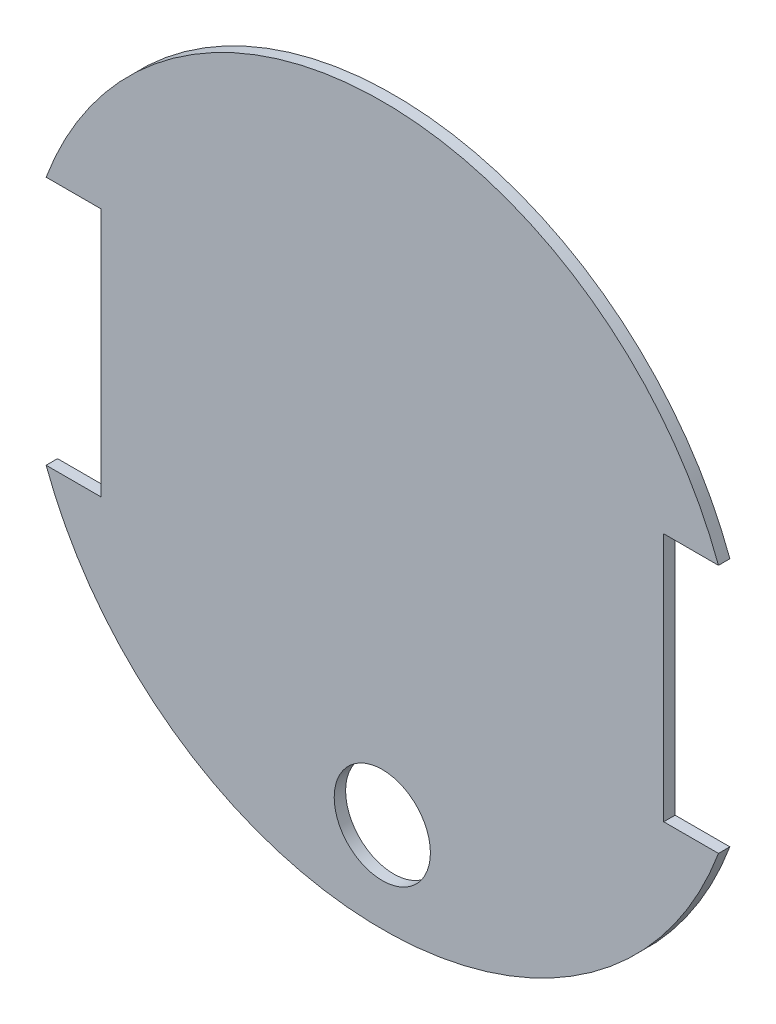
from build123d import *

# Parameters (mm, degrees)
P_IDAT_VYSUNUT_M4_DEPTH  = 1.5
SKICA14_W                = 0.314102564
SKICA14_H                = 3.58974359
P_IDAT_VYSUNUT_M14_DEPTH = 0.01
SKICA15_R                = 6.325
ODEBRAT_VYSUNUT_M1_DEPTH = 1.5


with BuildPart() as part:
    # Skica1 → Přidat vysunutím4 (new body)
    with BuildSketch(Plane.XY):
        with BuildLine():
            Line((-44.205910238, 16.4), (-37.005910238, 16.4))
            Line((-37.005910238, 16.4), (-37.005910238, 0))
            Line((-37.005910238, 0), (-37.005910238, -16.4))
            Line((-37.005910238, -16.4), (-44.205910238, -16.4))
            ThreePointArc((-44.205910238, -16.4), (0, -47.15), (44.205910238, -16.4))
            Line((44.205910238, -16.4), (37.005910238, -16.4))
            Line((37.005910238, -16.4), (37.005910238, 16.4))
            Line((37.005910238, 16.4), (44.205910238, 16.4))
            ThreePointArc((44.205910238, 16.4), (0, 47.15), (-44.205910238, 16.4))
        make_face()
    extrude(amount=P_IDAT_VYSUNUT_M4_DEPTH)

    # Skica14 → Přidat vysunutím14 (add)
    # profile 1 of 8: a face of its own
    with BuildSketch(Plane(origin=(0, 0, 0), x_dir=(-1, 0, 0), z_dir=(0, 0, -1))):
        with BuildLine():
            Line((18.951699298, -12.703544278), (19.249365437, -12.349113899))
            add(Edge.make_bspline(
                [(19.249365437, -12.349113899), (19.277774168, -12.377276494), (19.33296847, -12.431992585), (19.420532798, -12.503890464), (19.507934637, -12.56555007), (19.596192899, -12.615806732), (19.685044181, -12.654887688), (19.774370322, -12.682892359), (19.864095921, -12.700278444), (19.924231735, -12.702461158), (19.954072715, -12.703544278)],
                knots=[0, 0, 0, 0, 1.184182548, 2.300705631, 3.35101465, 4.348713429, 5.30352364, 6.219997949, 7.11671595, 8, 8, 8, 8], degree=3))
            add(Edge.make_bspline(
                [(19.954072715, -12.703544278), (19.978555201, -12.702781352), (20.026531658, -12.701286304), (20.097337158, -12.692385711), (20.165388961, -12.67615782), (20.231146838, -12.654301944), (20.294042089, -12.625385352), (20.354419906, -12.590815391), (20.412039743, -12.549661436), (20.466444479, -12.503025607), (20.515558167, -12.451396252), (20.559841777, -12.397479038), (20.596378637, -12.340278732), (20.627420876, -12.281232311), (20.650889524, -12.219364306), (20.66768728, -12.155100755), (20.677411997, -12.088434483), (20.67883051, -12.043171623), (20.679547399, -12.020296652)],
                knots=[0, 0, 0, 0, 1.062343549, 2.081793441, 3.089526549, 4.093074039, 5.083149132, 6.08769478, 7.107144672, 8.150642072, 9.191446818, 10.195194019, 11.172636708, 12.130818574, 13.084597393, 14.036430313, 15.007649973, 16, 16, 16, 16], degree=3))
            add(Edge.make_bspline(
                [(20.679547399, -12.020296652), (20.67869788, -11.995336478), (20.677028474, -11.946286788), (20.665368103, -11.87426166), (20.644157489, -11.806108981), (20.615791124, -11.741427558), (20.579433929, -11.680192302), (20.533845118, -11.623589824), (20.480897073, -11.569802345), (20.420087392, -11.520504096), (20.353252936, -11.475532844), (20.280706375, -11.436833514), (20.203719813, -11.403401331), (20.121674382, -11.37640517), (20.034975108, -11.355985544), (19.94368478, -11.340537352), (19.8474204, -11.331499982), (19.781491639, -11.330591203), (19.747783158, -11.330126557)],
                knots=[0, 0, 0, 0, 0.924643325, 1.817033356, 2.693143411, 3.56196673, 4.428389689, 5.322865367, 6.247706245, 7.219663084, 8.217806515, 9.227523221, 10.261305886, 11.32367458, 12.422559067, 13.558072142, 14.751475423, 16, 16, 16, 16], degree=3))
            add(Edge.make_bspline(
                [(19.747783158, -11.330126557), (19.734625478, -11.330222592), (19.706667713, -11.33042665), (19.662142588, -11.333665368), (19.612289908, -11.337716336), (19.577253316, -11.3413601), (19.558799772, -11.343279247)],
                knots=[0, 0, 0, 0, 0.832906839, 1.769781085, 2.82535828, 4, 4, 4, 4], degree=3))
            Line((19.558799772, -11.343279247), (19.718016544, -10.975696177))
            add(Edge.make_bspline(
                [(19.718016544, -10.975696177), (19.785657337, -10.976336571), (19.918518319, -10.977594442), (20.05101642, -10.987464825), (20.116058475, -10.992310101)],
                knots=[0, 0, 0, 0, 1.018219075, 2, 2, 2, 2], degree=3))
            add(Edge.make_bspline(
                [(20.116058475, -10.992310101), (20.143608766, -10.985009399), (20.198250267, -10.970529649), (20.277606205, -10.943588549), (20.353387431, -10.91225989), (20.425780198, -10.877080355), (20.493979593, -10.836823843), (20.559117305, -10.792889124), (20.620565197, -10.744678028), (20.67764768, -10.69209779), (20.729977739, -10.637695838), (20.775027033, -10.581018114), (20.814398673, -10.524625301), (20.845390866, -10.466489061), (20.871161684, -10.408260565), (20.888027903, -10.34855984), (20.899146831, -10.288248538), (20.900424487, -10.247732684), (20.901066386, -10.227377348)],
                knots=[0, 0, 0, 0, 1.165133019, 2.310850931, 3.423457707, 4.516327187, 5.598884803, 6.658713927, 7.727034368, 8.788835502, 9.829936608, 10.809811876, 11.746681257, 12.637474477, 13.499729694, 14.34472607, 15.168383402, 16, 16, 16, 16], degree=3))
            add(Edge.make_bspline(
                [(20.901066386, -10.227377348), (20.900724959, -10.209818724), (20.900052776, -10.175250318), (20.893046401, -10.124648749), (20.881159968, -10.076724179), (20.865235437, -10.031136764), (20.844291017, -9.987968132), (20.818646091, -9.947203828), (20.788520136, -9.908673716), (20.754133458, -9.873015344), (20.716123312, -9.840558333), (20.67528886, -9.811870658), (20.631359611, -9.788560877), (20.585153653, -9.768710766), (20.536109561, -9.753845009), (20.484548119, -9.742464711), (20.430255811, -9.736372644), (20.393201729, -9.735589861), (20.374266544, -9.735189848)],
                knots=[0, 0, 0, 0, 1.041626635, 2.05069436, 3.023903287, 3.968159788, 4.911422648, 5.86516543, 6.821265075, 7.809201593, 8.799981644, 9.783923408, 10.764332499, 11.746175287, 12.764125496, 13.800969656, 14.876262945, 16, 16, 16, 16], degree=3))
            add(Edge.make_bspline(
                [(20.374266544, -9.735189848), (20.352556696, -9.735550862), (20.309967782, -9.736259074), (20.24782261, -9.742907684), (20.188388535, -9.752017398), (20.132566, -9.766980935), (20.079218727, -9.784627446), (20.02965134, -9.807727861), (19.982742134, -9.834131543), (19.93900043, -9.864548282), (19.898632082, -9.899564144), (19.861329318, -9.938251054), (19.826921789, -9.981034487), (19.796066291, -10.027950643), (19.76807845, -10.079123508), (19.743403725, -10.134235558), (19.721792357, -10.193505319), (19.710138317, -10.234679068), (19.704171608, -10.255759468)],
                knots=[0, 0, 0, 0, 1.124438518, 2.205847547, 3.23580198, 4.236257647, 5.196617452, 6.143561762, 7.06448614, 7.983234858, 8.898788462, 9.828902619, 10.764380359, 11.73929134, 12.734518171, 13.783382522, 14.865121964, 16, 16, 16, 16], degree=3))
            Line((19.704171608, -10.255759468), (19.562953253, -10.255759468))
            Line((19.562953253, -10.255759468), (19.638408158, -9.731036367))
            add(Edge.make_bspline(
                [(19.638408158, -9.731036367), (19.680570379, -9.720600834), (19.763020267, -9.700193737), (19.885092062, -9.675006849), (20.00230202, -9.652711116), (20.115045044, -9.63356988), (20.223625352, -9.619863628), (20.327767089, -9.61030305), (20.427250307, -9.603529918), (20.492168892, -9.602688382), (20.523791861, -9.602278456)],
                knots=[0, 0, 0, 0, 1.162252488, 2.272830659, 3.334969625, 4.355229883, 5.332558806, 6.262852798, 7.153805453, 8, 8, 8, 8], degree=3))
            add(Edge.make_bspline(
                [(20.523791861, -9.602278456), (20.555647405, -9.602612467), (20.617823447, -9.603264394), (20.708452084, -9.610197909), (20.794162457, -9.622086726), (20.875068696, -9.63794299), (20.95171507, -9.657529636), (21.023018786, -9.683484995), (21.089708138, -9.713208636), (21.15142762, -9.746745519), (21.206550128, -9.784914672), (21.255556662, -9.825230377), (21.295905009, -9.869851131), (21.330791295, -9.915918176), (21.356183923, -9.966614689), (21.375225084, -10.019513158), (21.386689721, -10.075746669), (21.387827244, -10.114257282), (21.388408158, -10.133924025)],
                knots=[0, 0, 0, 0, 1.356238434, 2.647122798, 3.867146827, 5.038731331, 6.15646487, 7.231806646, 8.265353271, 9.263596312, 10.217479168, 11.11698148, 11.958367335, 12.773942467, 13.569322066, 14.361783278, 15.163389392, 16, 16, 16, 16], degree=3))
            add(Edge.make_bspline(
                [(21.388408158, -10.133924025), (21.387558947, -10.15520703), (21.385857034, -10.197860497), (21.373589053, -10.26107101), (21.354170991, -10.323454617), (21.325943168, -10.384512232), (21.290573932, -10.444862439), (21.247139892, -10.504172474), (21.195517458, -10.562108317), (21.13664923, -10.619893463), (21.068972309, -10.675615295), (20.994282466, -10.731099014), (20.911364578, -10.78512996), (20.820640565, -10.838156226), (20.722408351, -10.890861551), (20.615991559, -10.941940301), (20.502072175, -10.992592356), (20.422614129, -11.023983153), (20.38188126, -11.040075133)],
                knots=[0, 0, 0, 0, 0.713388079, 1.429707616, 2.151647064, 2.899614689, 3.679942097, 4.494028646, 5.360245398, 6.279511915, 7.257354267, 8.29733034, 9.398299809, 10.57408599, 11.820325085, 13.135406291, 14.531512841, 16, 16, 16, 16], degree=3))
            add(Edge.make_bspline(
                [(20.38188126, -11.040075133), (20.413606651, -11.049179072), (20.475715837, -11.067001967), (20.5644828, -11.099005529), (20.647481504, -11.133009585), (20.724606837, -11.169297794), (20.794978265, -11.209758148), (20.860119746, -11.251686182), (20.918295059, -11.297820306), (20.97098979, -11.345822763), (21.017265264, -11.397105297), (21.057668834, -11.450799095), (21.090856568, -11.508268238), (21.118858372, -11.567878028), (21.140440774, -11.630548765), (21.155324211, -11.696023332), (21.165753645, -11.764063459), (21.166506813, -11.81050526), (21.166889171, -11.834082253)],
                knots=[0, 0, 0, 0, 1.308473262, 2.561614107, 3.739151173, 4.864630859, 5.938258354, 6.955919155, 7.933379343, 8.878794323, 9.779261753, 10.668643349, 11.53803201, 12.405878518, 13.276854665, 14.160191117, 15.06598886, 16, 16, 16, 16], degree=3))
            add(Edge.make_bspline(
                [(21.166889171, -11.834082253), (21.165800835, -11.868566651), (21.163642933, -11.936940669), (21.143008172, -12.037256015), (21.112175798, -12.13451229), (21.067075273, -12.228157095), (21.008840759, -12.318096212), (20.939643335, -12.406080018), (20.856009182, -12.488973128), (20.762455817, -12.568420737), (20.659992243, -12.640824031), (20.552650156, -12.705901189), (20.440153533, -12.759963042), (20.323170752, -12.803433863), (20.202444736, -12.838311571), (20.07722263, -12.863332691), (19.947504153, -12.878011348), (19.859503035, -12.879835532), (19.814931101, -12.880759468)],
                knots=[0, 0, 0, 0, 0.877123033, 1.73911767, 2.597620405, 3.470204761, 4.376503808, 5.321721848, 6.314769606, 7.369593341, 8.444070241, 9.506217134, 10.562725278, 11.617025154, 12.680828632, 13.759458905, 14.865182034, 16, 16, 16, 16], degree=3))
            add(Edge.make_bspline(
                [(19.814931101, -12.880759468), (19.777765226, -12.88022783), (19.70357201, -12.879166534), (19.592899194, -12.870582976), (19.483374911, -12.856829468), (19.375024996, -12.837326195), (19.267591338, -12.81237078), (19.161074871, -12.781915778), (19.055428709, -12.745984914), (18.986406434, -12.717744618), (18.951699298, -12.703544278)],
                knots=[0, 0, 0, 0, 1.005246285, 2.006745515, 3.000825839, 3.990113116, 4.983350443, 5.983058568, 6.985801896, 8, 8, 8, 8], degree=3))
        make_face()
    # profile 2 of 8: a face of its own
    with BuildSketch(Plane(origin=(0, 0, 0), x_dir=(-1, 0, 0), z_dir=(0, 0, -1))):
        with BuildLine():
            Line((22.238487272, -12.171898709), (22.4073955, -11.476882886))
            Line((22.4073955, -11.476882886), (22.705061639, -10.001012633))
            Line((22.705061639, -10.001012633), (22.601916861, -10.001012633))
            add(Edge.make_bspline(
                [(22.601916861, -10.001012633), (22.566795665, -10.001719598), (22.496994682, -10.003124645), (22.393842979, -10.017178458), (22.292928301, -10.037411841), (22.194878678, -10.067373542), (22.10001334, -10.106570387), (22.007202925, -10.153111144), (21.9170341, -10.208402873), (21.86018233, -10.251355088), (21.831446133, -10.273065639)],
                knots=[0, 0, 0, 0, 1.011266354, 2.009822935, 2.99418231, 3.974154483, 4.958064789, 5.948087302, 6.9628438, 8, 8, 8, 8], degree=3))
            Line((21.831446133, -10.273065639), (21.911746766, -9.85494855))
            add(Edge.make_bspline(
                [(21.911746766, -9.85494855), (21.935456789, -9.838126884), (21.982685418, -9.804619355), (22.058930755, -9.762040715), (22.139538586, -9.727316736), (22.223643113, -9.696823806), (22.312252848, -9.674307622), (22.404867416, -9.658553329), (22.501325884, -9.648618845), (22.56704945, -9.647269618), (22.600532367, -9.646582253)],
                knots=[0, 0, 0, 0, 0.952250715, 1.896813718, 2.855050855, 3.826122163, 4.825718216, 5.846401831, 6.902847886, 8, 8, 8, 8], degree=3))
            Line((22.600532367, -9.646582253), (25.508661323, -9.646582253))
            Line((25.508661323, -9.646582253), (25.444974614, -10.001012633))
            Line((25.444974614, -10.001012633), (24.719499931, -10.001012633))
            Line((24.719499931, -10.001012633), (24.460599614, -11.242211209))
            add(Edge.make_bspline(
                [(24.460599614, -11.242211209), (24.452584789, -11.28122015), (24.4375023, -11.354628114), (24.415306457, -11.457994447), (24.3985389, -11.548418873), (24.383882219, -11.625462036), (24.37193202, -11.688854236), (24.363521978, -11.739135683), (24.358057584, -11.776049451), (24.357122434, -11.796461215), (24.356762589, -11.804315639)],
                knots=[0, 0, 0, 0, 1.671190624, 3.144886699, 4.436281524, 5.53018567, 6.436123431, 7.142932325, 7.670201336, 8, 8, 8, 8], degree=3))
            add(Edge.make_bspline(
                [(24.356762589, -11.804315639), (24.357054883, -11.815664392), (24.357610034, -11.83721891), (24.364626029, -11.867532648), (24.376083917, -11.89348791), (24.392776709, -11.914365601), (24.4136544, -11.931058393), (24.439609663, -11.942516281), (24.4699234, -11.949532276), (24.491477918, -11.950087427), (24.502826671, -11.950379721)],
                knots=[0, 0, 0, 0, 1.148537895, 2.181400912, 3.134041477, 4, 4.865958523, 5.818599088, 6.851462105, 8, 8, 8, 8], degree=3))
            add(Edge.make_bspline(
                [(24.502826671, -11.950379721), (24.528105874, -11.948938417), (24.580833098, -11.945932153), (24.661177317, -11.923413823), (24.745378131, -11.88832853), (24.833581231, -11.838876263), (24.926305949, -11.776252879), (25.0231464, -11.699550375), (25.124388051, -11.609170916), (25.191257778, -11.542306044), (25.226224614, -11.507341747)],
                knots=[0, 0, 0, 0, 0.698595655, 1.457127073, 2.292725134, 3.218251204, 4.248478895, 5.384820681, 6.63249708, 8, 8, 8, 8], degree=3))
            Line((25.226224614, -11.507341747), (25.18330531, -11.684556937))
            add(Edge.make_bspline(
                [(25.18330531, -11.684556937), (25.142783081, -11.726651621), (25.064614039, -11.807853991), (24.942305255, -11.91657301), (24.820404632, -12.008473849), (24.698943802, -12.083968646), (24.577953762, -12.142922406), (24.457223837, -12.184972873), (24.336894419, -12.211198784), (24.256510482, -12.214551567), (24.216928728, -12.216202506)],
                knots=[0, 0, 0, 0, 1.236054888, 2.384400543, 3.458601738, 4.462701024, 5.406117766, 6.300191324, 7.162999345, 8, 8, 8, 8], degree=3))
            add(Edge.make_bspline(
                [(24.216928728, -12.216202506), (24.189586791, -12.215359248), (24.137966483, -12.213767217), (24.066053289, -12.196198553), (24.004448429, -12.167961514), (23.954557454, -12.126339562), (23.915534833, -12.073413907), (23.887798224, -12.009120427), (23.872295696, -11.933336682), (23.870418768, -11.879383006), (23.869420817, -11.850696177)],
                knots=[0, 0, 0, 0, 1.133438616, 2.13987948, 3.052922752, 3.924117699, 4.807716669, 5.760338748, 6.809186249, 8, 8, 8, 8], degree=3))
            add(Edge.make_bspline(
                [(23.869420817, -11.850696177), (23.870051595, -11.842844444), (23.871764391, -11.821524094), (23.877600317, -11.781290895), (23.88854577, -11.724702294), (23.902258931, -11.651299178), (23.919414321, -11.561460837), (23.941186322, -11.455145298), (23.966596014, -11.332343045), (23.985420542, -11.244966075), (23.995409741, -11.198599658)],
                knots=[0, 0, 0, 0, 0.284506441, 0.772539844, 1.467388619, 2.366536235, 3.470000196, 4.771238699, 6.286664169, 8, 8, 8, 8], degree=3))
            Line((23.995409741, -11.198599658), (24.250156576, -10.001012633))
            Line((24.250156576, -10.001012633), (23.155714329, -10.001012633))
            Line((23.155714329, -10.001012633), (22.718906576, -12.171898709))
            Line((22.718906576, -12.171898709), (22.238487272, -12.171898709))
        make_face()
    # profile 3 of 8: a face of its own
    with BuildSketch(Plane(origin=(0, 0, 0), x_dir=(-1, 0, 0), z_dir=(0, 0, -1))):
        with BuildLine():
            Line((-25.528275141, -9.273103818), (-24.841876904, -9.273103818))
            add(Edge.make_bspline(
                [(-24.841876904, -9.273103818), (-24.794665998, -9.273155714), (-24.704207805, -9.27325515), (-24.57449275, -9.276269896), (-24.456683018, -9.280296588), (-24.351032637, -9.285878481), (-24.257216539, -9.292475071), (-24.175659239, -9.30172711), (-24.105719683, -9.311387406), (-24.063813234, -9.321208813), (-24.044701423, -9.325687953)],
                knots=[0, 0, 0, 0, 1.415646017, 2.712440637, 3.8905458, 4.950247383, 5.884950622, 6.709939814, 7.411656543, 8, 8, 8, 8], degree=3))
            add(Edge.make_bspline(
                [(-24.044701423, -9.325687953), (-24.02050789, -9.332309902), (-23.972690912, -9.345397764), (-23.903789869, -9.371611488), (-23.838236024, -9.402693653), (-23.775804465, -9.438117593), (-23.717262382, -9.479403157), (-23.661736341, -9.524876775), (-23.609716361, -9.575588343), (-23.561494969, -9.630969083), (-23.517210172, -9.690089293), (-23.479080489, -9.753831523), (-23.447153262, -9.821122826), (-23.41976999, -9.891916397), (-23.400061536, -9.966806721), (-23.385214636, -10.045273433), (-23.375791009, -10.127308123), (-23.374888447, -10.183367991), (-23.374428988, -10.211905901)],
                knots=[0, 0, 0, 0, 0.999701418, 1.975846123, 2.934577507, 3.890451536, 4.834027766, 5.787354733, 6.749476667, 7.726910423, 8.712836071, 9.690891519, 10.682875813, 11.679750201, 12.712814741, 13.765529915, 14.8625177, 16, 16, 16, 16], degree=3))
            add(Edge.make_bspline(
                [(-23.374428988, -10.211905901), (-23.374850412, -10.240683678), (-23.375674958, -10.296989342), (-23.385571244, -10.37936213), (-23.398901435, -10.45808052), (-23.419398487, -10.532969971), (-23.446244161, -10.603585741), (-23.477736213, -10.671006973), (-23.515719744, -10.734086645), (-23.559364574, -10.793053763), (-23.607916168, -10.847963675), (-23.661169106, -10.89841847), (-23.718908399, -10.944122808), (-23.780950547, -10.985179152), (-23.847900395, -11.020635431), (-23.918742549, -11.052392736), (-23.994092765, -11.079063797), (-24.046235279, -11.093093858), (-24.072746295, -11.100227215)],
                knots=[0, 0, 0, 0, 1.121902311, 2.195077645, 3.232258892, 4.234102512, 5.217864754, 6.176164875, 7.132989551, 8.084763148, 9.034132444, 9.988522005, 10.94243251, 11.903244335, 12.886203696, 13.894208494, 14.929344452, 16, 16, 16, 16], degree=3))
            add(Edge.make_bspline(
                [(-24.072746295, -11.100227215), (-24.094673629, -11.104890196), (-24.142728657, -11.115109391), (-24.221871379, -11.126517847), (-24.314016765, -11.136255448), (-24.419039045, -11.143556586), (-24.53684395, -11.149806954), (-24.667495207, -11.154775048), (-24.811249284, -11.157504902), (-24.911520528, -11.157645695), (-24.963872097, -11.157719203)],
                knots=[0, 0, 0, 0, 0.601384939, 1.31797006, 2.144135048, 3.087295005, 4.142315834, 5.309527816, 6.595305764, 8, 8, 8, 8], degree=3))
            Line((-24.963872097, -11.157719203), (-25.214172577, -11.157719203))
            Line((-25.214172577, -11.157719203), (-25.214172577, -12.773103818))
            Line((-25.214172577, -12.773103818), (-25.528275141, -12.773103818))
            Line((-25.528275141, -12.773103818), (-25.528275141, -9.273103818))
        make_face()
        with BuildLine():
            Line((-25.214172577, -9.632078177), (-25.214172577, -10.798744844))
            Line((-25.214172577, -10.798744844), (-24.601392129, -10.806457183))
            add(Edge.make_bspline(
                [(-24.601392129, -10.806457183), (-24.571472203, -10.806472647), (-24.513712403, -10.806502499), (-24.43027618, -10.802517276), (-24.352866892, -10.797916743), (-24.281722317, -10.791180819), (-24.216810382, -10.781659562), (-24.158022854, -10.772047824), (-24.105815571, -10.758142461), (-24.044716369, -10.739419392), (-23.976633021, -10.707486777), (-23.902565473, -10.661136887), (-23.839794887, -10.602056178), (-23.78547659, -10.535628347), (-23.742370712, -10.461729218), (-23.71081472, -10.382660281), (-23.692273562, -10.299232431), (-23.689787369, -10.242144293), (-23.688531552, -10.213308145)],
                knots=[0, 0, 0, 0, 1.160613943, 2.240541288, 3.23993089, 4.169200891, 5.011653406, 5.7853311, 6.478053781, 7.106038997, 8.262395093, 9.384106736, 10.481365981, 11.59014053, 12.70357646, 13.786202915, 14.881775077, 16, 16, 16, 16], degree=3))
            add(Edge.make_bspline(
                [(-23.688531552, -10.213308145), (-23.689794198, -10.185169631), (-23.692304183, -10.129233749), (-23.710960046, -10.047254989), (-23.74230936, -9.969019284), (-23.785765955, -9.896046199), (-23.838507085, -9.829857395), (-23.899806428, -9.772360268), (-23.969519689, -9.726138565), (-24.03436792, -9.696305284), (-24.091969106, -9.678090008), (-24.142001066, -9.665345168), (-24.19849174, -9.655169561), (-24.26145952, -9.646930059), (-24.330416354, -9.639876597), (-24.405954669, -9.63509062), (-24.487788312, -9.632289164), (-24.544598883, -9.632150209), (-24.574048379, -9.632078177)],
                knots=[0, 0, 0, 0, 1.120700087, 2.227813068, 3.331159281, 4.466773991, 5.599788987, 6.693661531, 7.80175334, 8.91857717, 9.525282508, 10.207424825, 10.974604443, 11.810962634, 12.737642355, 13.736264703, 14.826523623, 16, 16, 16, 16], degree=3))
            Line((-24.574048379, -9.632078177), (-25.214172577, -9.632078177))
        make_face(mode=Mode.SUBTRACT)
    # profile 4 of 8: a face of its own
    with BuildSketch(Plane(origin=(0, 0, 0), x_dir=(-1, 0, 0), z_dir=(0, 0, -1))):
        with BuildLine():
            add(Edge.make_bspline(
                [(-21.510847257, -10.170539715), (-21.462855984, -10.171561607), (-21.368756826, -10.173565285), (-21.23094894, -10.194980251), (-21.099403805, -10.227727615), (-20.973617612, -10.272999177), (-20.855201317, -10.333681128), (-20.742430073, -10.406090419), (-20.635613064, -10.491873013), (-20.571590035, -10.558231081), (-20.539092449, -10.591913914)],
                knots=[0, 0, 0, 0, 1.054011418, 2.066658804, 3.057071809, 4.030435133, 4.997543892, 5.974964718, 6.972108034, 8, 8, 8, 8], degree=3))
            add(Edge.make_bspline(
                [(-20.539092449, -10.591913914), (-20.511110495, -10.6241279), (-20.455688115, -10.687932442), (-20.384622396, -10.791388055), (-20.323400836, -10.898528156), (-20.274337875, -11.010775482), (-20.235652851, -11.127150153), (-20.208187155, -11.248052165), (-20.19185022, -11.373214512), (-20.189647253, -11.45821835), (-20.188531552, -11.501268882)],
                knots=[0, 0, 0, 0, 1.025258237, 2.030674902, 3.01204498, 3.988269485, 4.97094183, 5.956517959, 6.965070386, 8, 8, 8, 8], degree=3))
            add(Edge.make_bspline(
                [(-20.188531552, -11.501268882), (-20.189512889, -11.54456894), (-20.191452057, -11.630131873), (-20.209795674, -11.756151239), (-20.23832676, -11.878346062), (-20.279158598, -11.996204755), (-20.331516707, -12.110087583), (-20.395407395, -12.219497132), (-20.471279012, -12.324649265), (-20.557283008, -12.424651104), (-20.652334885, -12.516817318), (-20.755451033, -12.597145588), (-20.864605067, -12.665967112), (-20.98124842, -12.721403528), (-21.104315907, -12.765113228), (-21.234072975, -12.795813245), (-21.370318045, -12.814374928), (-21.463345267, -12.816758502), (-21.510847257, -12.817975613)],
                knots=[0, 0, 0, 0, 0.998656419, 1.973391657, 2.932242238, 3.890759089, 4.846373663, 5.82037756, 6.809684879, 7.83454468, 8.860553229, 9.859544525, 10.845671541, 11.83227036, 12.833544569, 13.85385346, 14.904124723, 16, 16, 16, 16], degree=3))
            add(Edge.make_bspline(
                [(-21.510847257, -12.817975613), (-21.558581976, -12.816754417), (-21.652072836, -12.814362642), (-21.788798818, -12.795885359), (-21.918788437, -12.765127377), (-22.042017035, -12.721259884), (-22.159161882, -12.66596534), (-22.268948379, -12.597353651), (-22.372148295, -12.516793496), (-22.467220279, -12.424657558), (-22.553218885, -12.324647602), (-22.629091893, -12.219497564), (-22.692982219, -12.11008747), (-22.745340423, -11.996204785), (-22.786172236, -11.878346053), (-22.814703329, -11.756151241), (-22.833046943, -11.630131872), (-22.834986112, -11.54456894), (-22.835967449, -11.501268882)],
                knots=[0, 0, 0, 0, 1.099876186, 2.154163076, 3.173186993, 4.173200201, 5.163417411, 6.152872554, 7.150605724, 8.17532212, 9.198891216, 10.186952605, 11.159729845, 12.11414092, 13.071450619, 14.029093627, 15.002601286, 16, 16, 16, 16], degree=3))
            add(Edge.make_bspline(
                [(-22.835967449, -11.501268882), (-22.834844139, -11.458452336), (-22.832620177, -11.373682934), (-22.816299668, -11.248755873), (-22.788941112, -11.128058484), (-22.750209715, -11.012133008), (-22.700694524, -10.900377572), (-22.640333236, -10.792972741), (-22.568542604, -10.689984941), (-22.513340652, -10.626262861), (-22.485406552, -10.594017279)],
                knots=[0, 0, 0, 0, 1.031353054, 2.041901799, 3.029428768, 4.008703097, 4.981709435, 5.96992636, 6.972712378, 8, 8, 8, 8], degree=3))
            add(Edge.make_bspline(
                [(-22.485406552, -10.594017279), (-22.452957961, -10.56004234), (-22.389142097, -10.493224644), (-22.281793369, -10.40769212), (-22.169299548, -10.333776046), (-22.049574622, -10.274299831), (-21.923891764, -10.227461313), (-21.791672521, -10.194895798), (-21.653397006, -10.173642443), (-21.558837385, -10.171584265), (-21.510847257, -10.170539715)],
                knots=[0, 0, 0, 0, 1.027980169, 2.021703884, 2.998553061, 3.971491411, 4.943284454, 5.930300938, 6.949603206, 8, 8, 8, 8], degree=3))
        make_face()
        with BuildLine():
            add(Edge.make_bspline(
                [(-21.5122495, -10.484642279), (-21.546187112, -10.485606871), (-21.61318624, -10.487511154), (-21.711805825, -10.501995058), (-21.806745979, -10.524942563), (-21.898186823, -10.557546619), (-21.985819996, -10.599645518), (-22.069729398, -10.651353878), (-22.150161838, -10.711986834), (-22.225543901, -10.781449506), (-22.294726213, -10.857328501), (-22.35520419, -10.938176859), (-22.406629296, -11.022683206), (-22.449469455, -11.110935417), (-22.481376643, -11.203827831), (-22.504549666, -11.300308462), (-22.519019906, -11.400573878), (-22.520906285, -11.468734897), (-22.521864885, -11.503372247)],
                knots=[0, 0, 0, 0, 1.021534396, 2.016698045, 2.994645724, 3.958388632, 4.93408049, 5.916473867, 6.921342795, 7.962252576, 8.998418191, 10.008913653, 10.997312074, 11.973003931, 12.956656626, 13.948281152, 14.957379055, 16, 16, 16, 16], degree=3))
            add(Edge.make_bspline(
                [(-22.521864885, -11.503372247), (-22.520258061, -11.548124275), (-22.517068817, -11.63694868), (-22.49113358, -11.767759803), (-22.447747301, -11.893341655), (-22.389160021, -12.012958041), (-22.315753802, -12.123630319), (-22.229266736, -12.222301803), (-22.130627035, -12.307487615), (-22.021010535, -12.37816846), (-21.902656217, -12.434328216), (-21.777399896, -12.474127192), (-21.646759202, -12.499998884), (-21.557478471, -12.502570358), (-21.5122495, -12.503873049)],
                knots=[0, 0, 0, 0, 1.016792936, 2.018143844, 3.017858371, 4.030088057, 5.03801393, 6.028138512, 7.003788237, 7.991172063, 8.984598303, 9.972568034, 10.972917682, 12, 12, 12, 12], degree=3))
            add(Edge.make_bspline(
                [(-21.5122495, -12.503873049), (-21.467023131, -12.502562768), (-21.377747535, -12.499976312), (-21.247288359, -12.474257492), (-21.122374387, -12.434153831), (-21.004142999, -12.378231621), (-20.894576396, -12.307219207), (-20.795227274, -12.222782829), (-20.709478663, -12.123368978), (-20.636145058, -12.012811449), (-20.576598316, -11.893527097), (-20.533415114, -11.767736625), (-20.507417528, -11.636954583), (-20.504236699, -11.548126252), (-20.502634116, -11.503372247)],
                knots=[0, 0, 0, 0, 1.02726834, 2.027799167, 3.010890988, 4.004497153, 4.992059811, 5.971914811, 6.958719428, 7.966827853, 8.981595046, 9.981490638, 10.983022906, 12, 12, 12, 12], degree=3))
            add(Edge.make_bspline(
                [(-20.502634116, -11.503372247), (-20.503592386, -11.46873469), (-20.505478115, -11.400573264), (-20.519953079, -11.30031081), (-20.543108619, -11.203819214), (-20.575080236, -11.110967211), (-20.61773425, -11.022454706), (-20.670151043, -10.938424979), (-20.730382069, -10.857048433), (-20.800399189, -10.781694792), (-20.875702567, -10.711959756), (-20.956167605, -10.651330366), (-21.039952584, -10.599872771), (-21.127331167, -10.55718653), (-21.218783734, -10.52523919), (-21.313590864, -10.501862558), (-21.411789674, -10.487572362), (-21.478548717, -10.48562522), (-21.5122495, -10.484642279)],
                knots=[0, 0, 0, 0, 1.042956736, 2.052379634, 3.044323526, 4.02829302, 5.004299113, 5.996692471, 7.007513377, 8.048758398, 9.090003419, 10.095195979, 11.07790575, 12.047570684, 13.018257071, 13.989683339, 14.985167495, 16, 16, 16, 16], degree=3))
        make_face(mode=Mode.SUBTRACT)
    # profile 5 of 8: a face of its own
    with BuildSketch(Plane(origin=(0, 0, 0), x_dir=(-1, 0, 0), z_dir=(0, 0, -1))):
        with Locations((-19.448146936, -10.978232023)):
            Rectangle(SKICA14_W, SKICA14_H)
    # profile 6 of 8: a face of its own
    with BuildSketch(Plane(origin=(0, 0, 0), x_dir=(-1, 0, 0), z_dir=(0, 0, -1))):
        with BuildLine():
            add(Edge.make_bspline(
                [(-17.337770334, -10.170539715), (-17.289779061, -10.171561607), (-17.195679903, -10.173565285), (-17.057872017, -10.194980251), (-16.926326881, -10.227727615), (-16.800540689, -10.272999177), (-16.682124394, -10.333681128), (-16.56935315, -10.406090419), (-16.462536141, -10.491873013), (-16.398513112, -10.558231081), (-16.366015526, -10.591913914)],
                knots=[0, 0, 0, 0, 1.054011418, 2.066658804, 3.057071809, 4.030435133, 4.997543892, 5.974964718, 6.972108034, 8, 8, 8, 8], degree=3))
            add(Edge.make_bspline(
                [(-16.366015526, -10.591913914), (-16.338033572, -10.6241279), (-16.282611192, -10.687932442), (-16.211545473, -10.791388055), (-16.150323913, -10.898528156), (-16.101260952, -11.010775482), (-16.062575928, -11.127150153), (-16.035110232, -11.248052165), (-16.018773297, -11.373214512), (-16.01657033, -11.45821835), (-16.015454629, -11.501268882)],
                knots=[0, 0, 0, 0, 1.025258237, 2.030674902, 3.01204498, 3.988269485, 4.97094183, 5.956517959, 6.965070386, 8, 8, 8, 8], degree=3))
            add(Edge.make_bspline(
                [(-16.015454629, -11.501268882), (-16.016435966, -11.54456894), (-16.018375134, -11.630131873), (-16.036718751, -11.756151239), (-16.065249836, -11.878346062), (-16.106081675, -11.996204755), (-16.158439784, -12.110087583), (-16.222330471, -12.219497132), (-16.298202089, -12.324649265), (-16.384206085, -12.424651104), (-16.479257962, -12.516817318), (-16.58237411, -12.597145588), (-16.691528144, -12.665967112), (-16.808171497, -12.721403528), (-16.931238984, -12.765113228), (-17.060996052, -12.795813245), (-17.197241122, -12.814374928), (-17.290268343, -12.816758502), (-17.337770334, -12.817975613)],
                knots=[0, 0, 0, 0, 0.998656419, 1.973391657, 2.932242238, 3.890759089, 4.846373663, 5.82037756, 6.809684879, 7.83454468, 8.860553229, 9.859544525, 10.845671541, 11.83227036, 12.833544569, 13.85385346, 14.904124723, 16, 16, 16, 16], degree=3))
            add(Edge.make_bspline(
                [(-17.337770334, -12.817975613), (-17.385505053, -12.816754417), (-17.478995913, -12.814362642), (-17.615721895, -12.795885359), (-17.745711514, -12.765127377), (-17.868940112, -12.721259884), (-17.986084959, -12.66596534), (-18.095871456, -12.597353651), (-18.199071372, -12.516793496), (-18.294143356, -12.424657558), (-18.380141961, -12.324647602), (-18.45601497, -12.219497564), (-18.519905296, -12.11008747), (-18.5722635, -11.996204785), (-18.613095313, -11.878346053), (-18.641626405, -11.756151241), (-18.65997002, -11.630131872), (-18.661909189, -11.54456894), (-18.662890526, -11.501268882)],
                knots=[0, 0, 0, 0, 1.099876186, 2.154163076, 3.173186993, 4.173200201, 5.163417411, 6.152872554, 7.150605724, 8.17532212, 9.198891216, 10.186952605, 11.159729845, 12.11414092, 13.071450619, 14.029093627, 15.002601286, 16, 16, 16, 16], degree=3))
            add(Edge.make_bspline(
                [(-18.662890526, -11.501268882), (-18.661767216, -11.458452336), (-18.659543254, -11.373682934), (-18.643222745, -11.248755873), (-18.615864189, -11.128058484), (-18.577132792, -11.012133008), (-18.527617601, -10.900377572), (-18.467256313, -10.792972741), (-18.395465681, -10.689984941), (-18.340263729, -10.626262861), (-18.312329629, -10.594017279)],
                knots=[0, 0, 0, 0, 1.031353054, 2.041901799, 3.029428768, 4.008703097, 4.981709435, 5.96992636, 6.972712378, 8, 8, 8, 8], degree=3))
            add(Edge.make_bspline(
                [(-18.312329629, -10.594017279), (-18.279881038, -10.56004234), (-18.216065174, -10.493224644), (-18.108716446, -10.40769212), (-17.996222625, -10.333776046), (-17.876497699, -10.274299831), (-17.750814841, -10.227461313), (-17.618595598, -10.194895798), (-17.480320083, -10.173642443), (-17.385760462, -10.171584265), (-17.337770334, -10.170539715)],
                knots=[0, 0, 0, 0, 1.027980169, 2.021703884, 2.998553061, 3.971491411, 4.943284454, 5.930300938, 6.949603206, 8, 8, 8, 8], degree=3))
        make_face()
        with BuildLine():
            add(Edge.make_bspline(
                [(-17.339172577, -10.484642279), (-17.373110189, -10.485606871), (-17.440109317, -10.487511154), (-17.538728902, -10.501995058), (-17.633669056, -10.524942563), (-17.7251099, -10.557546619), (-17.812743072, -10.599645518), (-17.896652475, -10.651353878), (-17.977084915, -10.711986834), (-18.052466978, -10.781449506), (-18.12164929, -10.857328501), (-18.182127267, -10.938176859), (-18.233552373, -11.022683206), (-18.276392532, -11.110935417), (-18.30829972, -11.203827831), (-18.331472743, -11.300308462), (-18.345942983, -11.400573878), (-18.347829362, -11.468734897), (-18.348787962, -11.503372247)],
                knots=[0, 0, 0, 0, 1.021534396, 2.016698045, 2.994645724, 3.958388632, 4.93408049, 5.916473867, 6.921342795, 7.962252576, 8.998418191, 10.008913653, 10.997312074, 11.973003931, 12.956656626, 13.948281152, 14.957379055, 16, 16, 16, 16], degree=3))
            add(Edge.make_bspline(
                [(-18.348787962, -11.503372247), (-18.347181138, -11.548124275), (-18.343991894, -11.63694868), (-18.318056657, -11.767759803), (-18.274670378, -11.893341655), (-18.216083098, -12.012958041), (-18.142676879, -12.123630319), (-18.056189812, -12.222301803), (-17.957550112, -12.307487615), (-17.847933612, -12.37816846), (-17.729579294, -12.434328216), (-17.604322973, -12.474127192), (-17.473682279, -12.499998884), (-17.384401548, -12.502570358), (-17.339172577, -12.503873049)],
                knots=[0, 0, 0, 0, 1.016792936, 2.018143844, 3.017858371, 4.030088057, 5.03801393, 6.028138512, 7.003788237, 7.991172063, 8.984598303, 9.972568034, 10.972917682, 12, 12, 12, 12], degree=3))
            add(Edge.make_bspline(
                [(-17.339172577, -12.503873049), (-17.293946208, -12.502562768), (-17.204670612, -12.499976312), (-17.074211436, -12.474257492), (-16.949297464, -12.434153831), (-16.831066076, -12.378231621), (-16.721499473, -12.307219207), (-16.622150351, -12.222782829), (-16.53640174, -12.123368978), (-16.463068135, -12.012811449), (-16.403521393, -11.893527097), (-16.360338191, -11.767736625), (-16.334340605, -11.636954583), (-16.331159776, -11.548126252), (-16.329557193, -11.503372247)],
                knots=[0, 0, 0, 0, 1.02726834, 2.027799167, 3.010890988, 4.004497153, 4.992059811, 5.971914811, 6.958719428, 7.966827853, 8.981595046, 9.981490638, 10.983022906, 12, 12, 12, 12], degree=3))
            add(Edge.make_bspline(
                [(-16.329557193, -11.503372247), (-16.330515463, -11.46873469), (-16.332401192, -11.400573264), (-16.346876156, -11.30031081), (-16.370031696, -11.203819214), (-16.402003313, -11.110967211), (-16.444657327, -11.022454706), (-16.49707412, -10.938424979), (-16.557305145, -10.857048433), (-16.627322266, -10.781694792), (-16.702625644, -10.711959756), (-16.783090682, -10.651330366), (-16.866875661, -10.599872771), (-16.954254244, -10.55718653), (-17.045706811, -10.52523919), (-17.14051394, -10.501862558), (-17.23871275, -10.487572362), (-17.305471794, -10.48562522), (-17.339172577, -10.484642279)],
                knots=[0, 0, 0, 0, 1.042956736, 2.052379634, 3.044323526, 4.02829302, 5.004299113, 5.996692471, 7.007513377, 8.048758398, 9.090003419, 10.095195979, 11.07790575, 12.047570684, 13.018257071, 13.989683339, 14.985167495, 16, 16, 16, 16], degree=3))
        make_face(mode=Mode.SUBTRACT)
    # profile 7 of 8: a face of its own
    with BuildSketch(Plane(origin=(0, 0, 0), x_dir=(-1, 0, 0), z_dir=(0, 0, -1))):
        with Locations((-15.275070013, -10.978232023)):
            Rectangle(SKICA14_W, SKICA14_H)
    # profile 8 of 8: a face of its own
    with BuildSketch(Plane(origin=(0, 0, 0), x_dir=(-1, 0, 0), z_dir=(0, 0, -1))):
        with BuildLine():
            Line((-14.444941808, -10.21541151), (-14.130839244, -10.21541151))
            Line((-14.130839244, -10.21541151), (-14.130839244, -11.401709587))
            add(Edge.make_bspline(
                [(-14.130839244, -11.401709587), (-14.130697339, -11.436532336), (-14.130425882, -11.503146624), (-14.128584941, -11.599001811), (-14.124254847, -11.686418524), (-14.118841023, -11.765447261), (-14.111878886, -11.836074652), (-14.103595526, -11.898054009), (-14.094337104, -11.952088193), (-14.08527439, -11.984631549), (-14.081059597, -11.999766478)],
                knots=[0, 0, 0, 0, 1.388932606, 2.656963016, 3.823490214, 4.879454478, 5.816252168, 6.653371382, 7.373723809, 8, 8, 8, 8], degree=3))
            add(Edge.make_bspline(
                [(-14.081059597, -11.999766478), (-14.074298142, -12.018789349), (-14.0609158, -12.05643961), (-14.036642317, -12.110828615), (-14.00661398, -12.161203898), (-13.973754152, -12.209507971), (-13.935854745, -12.254309958), (-13.893395274, -12.295534201), (-13.847797037, -12.334738292), (-13.780042013, -12.381123084), (-13.687382747, -12.430838415), (-13.565729992, -12.473734233), (-13.433825766, -12.499370053), (-13.342661047, -12.502344308), (-13.295803186, -12.503873049)],
                knots=[0, 0, 0, 0, 0.725840625, 1.436591201, 2.137033971, 2.831655856, 3.53531722, 4.242432219, 4.957935707, 5.694543706, 7.190802206, 8.724350549, 10.316345118, 12, 12, 12, 12], degree=3))
            add(Edge.make_bspline(
                [(-13.295803186, -12.503873049), (-13.248949679, -12.5023118), (-13.15829681, -12.499291073), (-13.027841841, -12.474507534), (-12.908590427, -12.433101845), (-12.801739475, -12.375294434), (-12.707773635, -12.304552371), (-12.629469216, -12.221543562), (-12.564861962, -12.128894175), (-12.536652541, -12.059769896), (-12.522465847, -12.025006863)],
                knots=[0, 0, 0, 0, 1.157059328, 2.238695713, 3.266970494, 4.264342957, 5.228770407, 6.160125903, 7.074715775, 8, 8, 8, 8], degree=3))
            add(Edge.make_bspline(
                [(-12.522465847, -12.025006863), (-12.518271616, -12.011040564), (-12.508999198, -11.980164489), (-12.499036847, -11.92778474), (-12.490062385, -11.865320136), (-12.482399209, -11.792361927), (-12.476934046, -11.709100775), (-12.47398802, -11.615562699), (-12.470659744, -11.512041338), (-12.470609228, -11.439573579), (-12.470582834, -11.401709587)],
                knots=[0, 0, 0, 0, 0.557542046, 1.232589297, 2.036731608, 2.971723315, 4.038036528, 5.22795436, 6.551621927, 8, 8, 8, 8], degree=3))
            Line((-12.470582834, -11.401709587), (-12.470582834, -10.21541151))
            Line((-12.470582834, -10.21541151), (-12.15648027, -10.21541151))
            Line((-12.15648027, -10.21541151), (-12.15648027, -11.460603818))
            add(Edge.make_bspline(
                [(-12.15648027, -11.460603818), (-12.156921964, -11.502910989), (-12.157778913, -11.584992689), (-12.163286256, -11.704276801), (-12.172735869, -11.815439046), (-12.187078554, -11.918538266), (-12.203944229, -12.013495747), (-12.225700501, -12.100433193), (-12.251678739, -12.179082747), (-12.280984254, -12.250824524), (-12.315606122, -12.315871418), (-12.352433142, -12.377607235), (-12.394957914, -12.43450017), (-12.439728148, -12.489382307), (-12.489529804, -12.539523835), (-12.543429663, -12.586075311), (-12.600669083, -12.629748342), (-12.662518281, -12.668839622), (-12.728074344, -12.704056267), (-12.797418201, -12.735272345), (-12.871399199, -12.759974922), (-12.949062836, -12.781285588), (-13.030789615, -12.798000057), (-13.116500749, -12.809786624), (-13.206167365, -12.817011955), (-13.267276824, -12.817649), (-13.298607673, -12.817975613)],
                knots=[0, 0, 0, 0, 1.493040784, 2.896703357, 4.213163133, 5.428574705, 6.569057535, 7.615249723, 8.588095153, 9.490268104, 10.346124644, 11.18633936, 12.024365274, 12.850166724, 13.684164916, 14.514361689, 15.362232829, 16.222528818, 17.093394965, 17.986930858, 18.902426812, 19.842810585, 20.827885679, 21.843828298, 22.894529745, 24, 24, 24, 24], degree=3))
            add(Edge.make_bspline(
                [(-13.298607673, -12.817975613), (-13.329704188, -12.817635906), (-13.390811733, -12.81696835), (-13.480482977, -12.809826542), (-13.566431583, -12.798018371), (-13.648351982, -12.781163154), (-13.726326379, -12.760124084), (-13.800670619, -12.735120548), (-13.870514182, -12.704040067), (-13.936696186, -12.669062509), (-13.998698574, -12.629497234), (-14.056807152, -12.586129194), (-14.110944005, -12.539023131), (-14.161121073, -12.488375774), (-14.206634049, -12.433558838), (-14.248050091, -12.375013277), (-14.286006796, -12.313319189), (-14.320359587, -12.247256026), (-14.349871342, -12.174684016), (-14.375926588, -12.094386919), (-14.397237226, -12.005484403), (-14.414579695, -11.908052474), (-14.428531135, -11.802557432), (-14.438217278, -11.688389017), (-14.443633108, -11.565825325), (-14.44449617, -11.481175435), (-14.444941808, -11.437466799)],
                knots=[0, 0, 0, 0, 1.083640291, 2.129454052, 3.13281866, 4.105697902, 5.042300162, 5.946461698, 6.836384745, 7.703652036, 8.553297018, 9.397182691, 10.228592656, 11.052265423, 11.879314572, 12.708807002, 13.549817954, 14.402308542, 15.300838682, 16.27712199, 17.341985831, 18.484375296, 19.725102775, 21.0496083, 22.476576903, 24, 24, 24, 24], degree=3))
            Line((-14.444941808, -11.437466799), (-14.444941808, -10.21541151))
        make_face()
    extrude(amount=P_IDAT_VYSUNUT_M14_DEPTH)

    # Skica15 → Odebrat vysunutím1 (cut)
    with BuildSketch(Plane(origin=(0, 0, 0), x_dir=(-1, 0, 0), z_dir=(0, 0, -1))):
        with Locations((0, -35.275)):
            Circle(SKICA15_R)
    extrude(amount=-ODEBRAT_VYSUNUT_M1_DEPTH, mode=Mode.SUBTRACT)


solid = part.part
